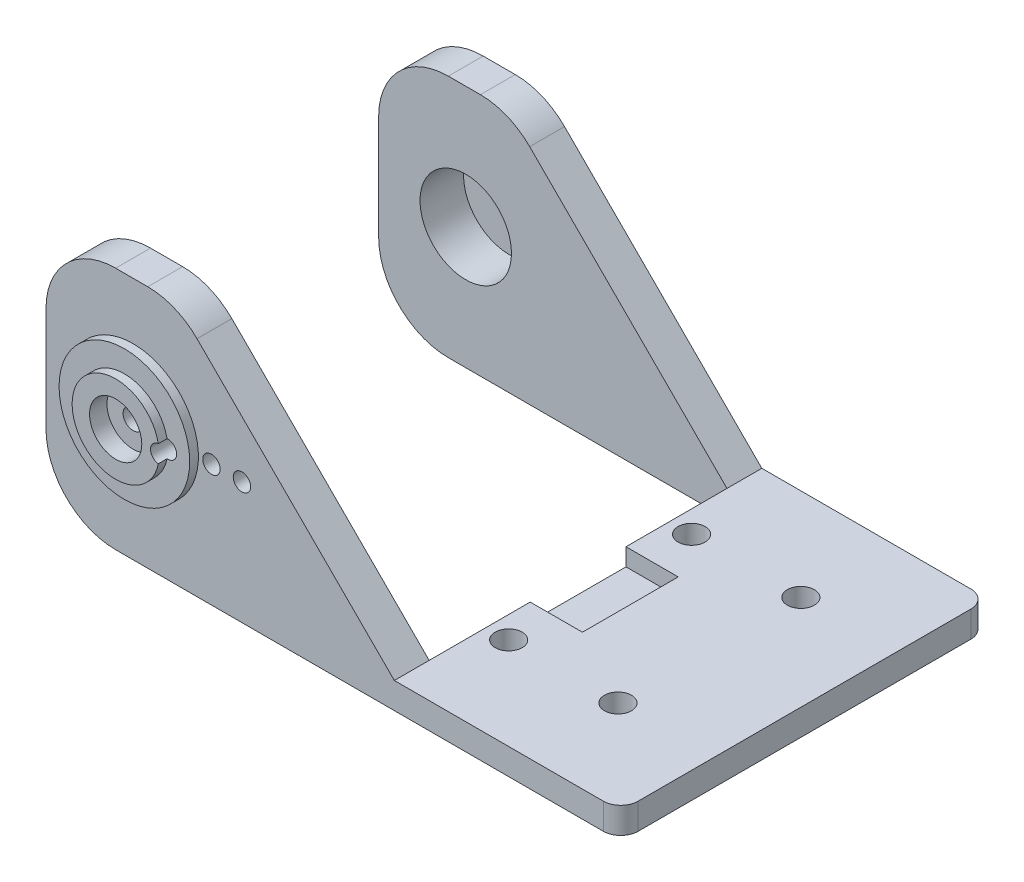
from build123d import *

# Parameters (mm, degrees)
PERFIL_LATERAL_DEPTH        = 42.2
SKETCH7_W                   = 40
SKETCH7_H                   = 34.2
CORTE_VERTICAL_PERFIL_DEPTH = 84.191586113
SKETCH8_R                   = 6
SOPORTE_AL_EJE_GIRO_1_DEPTH = 2
SKETCH10_R                  = 7.5
SOPORTE_AL_EJE_GIRO_2_DEPTH = 1
SKETCH11_R                  = 5.25
EJE_GIRO_DEPTH              = 5
SERVO_HORN_BED_DEPTH        = 2.5
SKETCH13_R                  = 1.55
HUECOS_BASE_LASER_DEPTH     = 83.230408001
FILLET1_R                   = 8
DECORACION_START            = 1
SKETCH14_R                  = 7.5
DECORACION_HORN_DEPTH       = 1
SKETCH15_R                  = 5
DECORACION_HORN_2_DEPTH     = 1
TORNILLOS_HORN_DEPTH        = 85.22374962
TORNILLOS_HORN_DEPTH_BACK   = 1.5
SKETCH12_R                  = 1.15
SKETCH12_R_2                = 1
SKETCH16_R                  = 3
CABEZA_TORNILLO_HORN_DEPTH  = 2
SKETCH17_W                  = 12
SKETCH17_H                  = 11
CUT_EXTRUDE9_DEPTH          = 2
FILLET2_R                   = 2


with BuildPart() as part:
    # Sketch6 → Perfil lateral (new body)
    with BuildSketch(Plane.XY):
        Polygon((0, 0), (15, 0), (40, -25), (66, -25), (66, -28), (0, -28), align=None)
    extrude(amount=PERFIL_LATERAL_DEPTH)

    # Sketch7 → Corte vertical perfil (cut, through all)
    with BuildSketch(Plane(origin=(0, 0, 0), x_dir=(1, 0, 0), z_dir=(0, 1, 0))):
        with Locations((20, -21.1)):
            Rectangle(SKETCH7_W, SKETCH7_H)
    extrude(amount=-CORTE_VERTICAL_PERFIL_DEPTH, mode=Mode.SUBTRACT)

    # Sketch8 → soporte al eje giro 1 (add)
    with BuildSketch(Plane.XY):
        with Locations((10, -14)):
            Circle(SKETCH8_R)
    extrude(amount=-SOPORTE_AL_EJE_GIRO_1_DEPTH)

    # Sketch10 → soporte al eje giro 2 (add)
    with BuildSketch(Plane(origin=(0, 0, 0), x_dir=(-1, 0, 0), z_dir=(0, 0, -1))):
        with Locations((-10, -14)):
            Circle(SKETCH10_R)
    extrude(amount=SOPORTE_AL_EJE_GIRO_2_DEPTH)

    # Sketch11 → eje giro (cut)
    with BuildSketch(Plane.XY.offset(4)):
        with Locations((10, -14)):
            Circle(SKETCH11_R)
    extrude(amount=-EJE_GIRO_DEPTH, mode=Mode.SUBTRACT)

    # Sketch9 → servo horn bed (cut)
    with BuildSketch(Plane.XY.offset(38.2)):
        with BuildLine():
            Line((0, -17.7), (10, -17.7))
            Line((10, -17.7), (25, -16.012614746))
            ThreePointArc((25, -16.012614746), (27, -14), (25, -11.987385254))
            Line((25, -11.987385254), (10, -10.3))
            Line((10, -10.3), (0, -10.3))
            Line((0, -10.3), (0, -17.7))
        make_face()
    extrude(amount=SERVO_HORN_BED_DEPTH, mode=Mode.SUBTRACT)

    # Sketch13 → Huecos base laser (cut, through all)
    with BuildSketch(Plane(origin=(0, -25, 0), x_dir=(1, 0, 0), z_dir=(0, 1, 0))):
        with Locations(Location((55.079807472, -31.6, 0), (0, 0, 270))):
            Circle(SKETCH13_R)
        with Locations(Location((42.529807472, -31.6, 0), (0, 0, 270))):
            Circle(SKETCH13_R)
        with Locations(Location((42.529807472, -10.6, 0), (0, 0, 270))):
            Circle(SKETCH13_R)
        with Locations(Location((55.079807472, -10.6, 0), (0, 0, 270))):
            Circle(SKETCH13_R)
    extrude(amount=-HUECOS_BASE_LASER_DEPTH, mode=Mode.SUBTRACT)

    # Fillet1
    fillet1_edges = [part.edges().sort_by_distance(p)[0] for p in [
        (0, 0, 40.2),
        (15, 0, 40.2),
        (0, -28, 40.2),
        (0, 0, 2),
        (15, 0, 2),
        (0, -28, 2),
    ]]
    fillet(fillet1_edges, radius=FILLET1_R)

    # Sketch14 → Decoracion horn (add)
    with BuildSketch(Plane.XY.offset(42.2).offset(DECORACION_START)):
        with Locations(Location((10, -14, 0), (0, 0, 180))):
            Circle(SKETCH14_R)
    extrude(amount=-DECORACION_HORN_DEPTH)

    # Sketch15 → Decoracion Horn 2 (add)
    with BuildSketch(Plane.XY.offset(43.2)):
        with Locations((10, -14)):
            Circle(SKETCH15_R)
    extrude(amount=DECORACION_HORN_2_DEPTH)

    # Sketch12 → Tornillos horn (cut, two sides: drawn at the far end of the back side and taken through both)
    with BuildSketch(Plane.XY.offset(42.2).offset(-TORNILLOS_HORN_DEPTH_BACK)):
        with Locations((10, -14)):
            Circle(SKETCH12_R)
        with Locations(Location((15, -14, 0), (0, 0, 264.260829523))):
            Circle(SKETCH12_R_2)
        with Locations(Location((19, -14, 0), (0, 0, 180))):
            Circle(SKETCH12_R_2)
        with Locations(Location((22.5, -14, 0), (0, 0, 180))):
            Circle(SKETCH12_R_2)
    extrude(amount=TORNILLOS_HORN_DEPTH + TORNILLOS_HORN_DEPTH_BACK, mode=Mode.SUBTRACT)

    # Sketch16 → cabeza tornillo horn (cut)
    with BuildSketch(Plane.XY.offset(44.2)):
        with Locations((10, -14)):
            Circle(SKETCH16_R)
    extrude(amount=-CABEZA_TORNILLO_HORN_DEPTH, mode=Mode.SUBTRACT)

    # Sketch17 → Cut-Extrude9 (cut)
    with BuildSketch(Plane(origin=(0, -25, 0), x_dir=(1, 0, 0), z_dir=(0, 1, 0))):
        with Locations((40, -21.1)):
            Rectangle(SKETCH17_W, SKETCH17_H)
    extrude(amount=-CUT_EXTRUDE9_DEPTH, mode=Mode.SUBTRACT)

    # Fillet2
    fillet2_edges = [part.edges().sort_by_distance(p)[0] for p in [
        (66, -26.5, 42.2),
        (66, -26.5, 0),
    ]]
    fillet(fillet2_edges, radius=FILLET2_R)


solid = part.part
